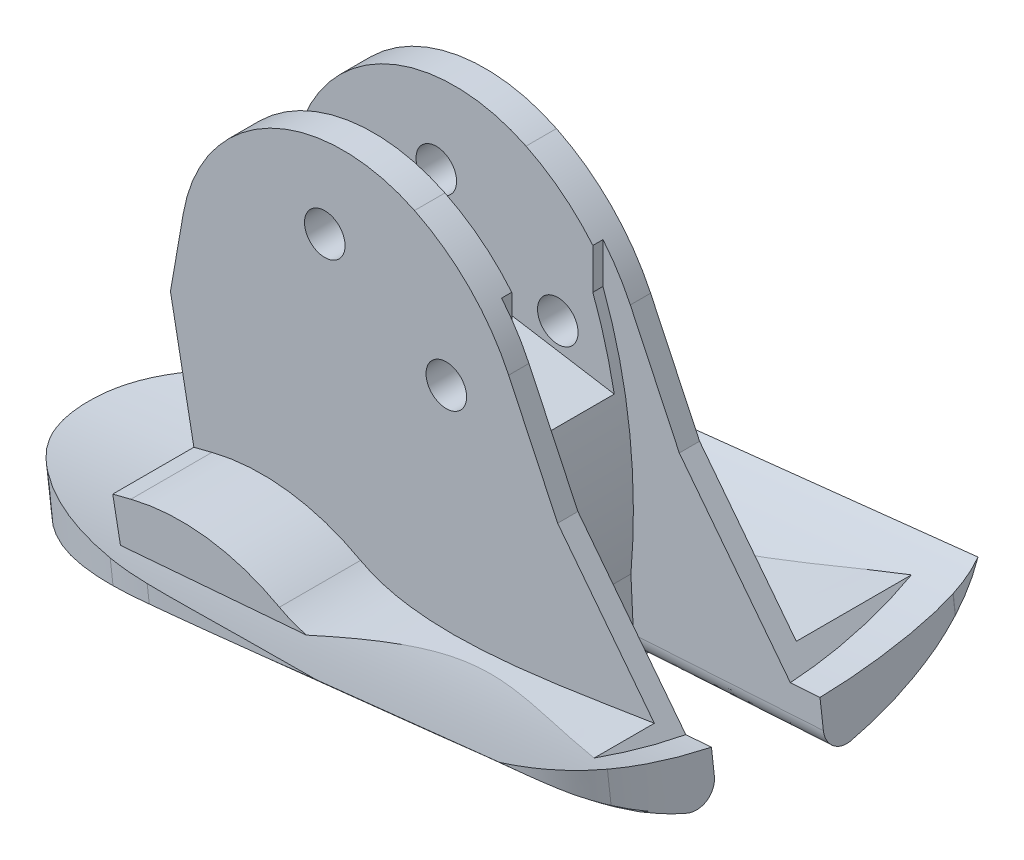
from build123d import *

# Parameters (mm, degrees)
SKETCH10_R                = 1
BOSS_EXTRUDE5_DEPTH       = 7.5
CUT_EXTRUDE1_DEPTH        = 4
FILLET1_R                 = 10
CUT_EXTRUDE6_START        = -11
CUT_EXTRUDE6_DEPTH        = 10
CUT_EXTRUDE7_DEPTH        = 2
BOSS_EXTRUDE11_DEPTH      = 9
CUT_EXTRUDE9_DEPTH        = 9
FILLET2_R                 = 8
FILLET3_R                 = 10
BOSS_EXTRUDE15_DEPTH      = 2
BOSS_EXTRUDE16_DEPTH      = 50
BOSS_EXTRUDE16_DEPTH_BACK = 10
CUT_EXTRUDE10_DEPTH       = 72
CUT_EXTRUDE10_DEPTH_BACK  = 30
SKETCH35_R                = 55.402587586
CUT_EXTRUDE11_DEPTH       = 35
CUT_EXTRUDE11_DEPTH_BACK  = 10
CUT_EXTRUDE13_DEPTH       = 2.5
FILLET4_R                 = 1
CUT_EXTRUDE14_DEPTH       = 10
CUT_EXTRUDE14_DEPTH_BACK  = 10


with BuildPart() as part:
    # Sketch10 → Boss-Extrude5 (new, symmetric)
    with BuildSketch(Plane.XY):
        Polygon((24.800982713, 46.206909386), (29.373769335, 36.52146178), (36.993816658, 26.682834617), (12.788755024, 23.658848526), (10.279677841, 36.875809012), (12.321789019, 48.656944563), align=None)
        with Locations((17.890076876, 43.12952492)):
            Circle(SKETCH10_R, mode=Mode.SUBTRACT)
        with Locations((23.882298789, 39.668364252)):
            Circle(SKETCH10_R, mode=Mode.SUBTRACT)
    extrude(amount=BOSS_EXTRUDE5_DEPTH, both=True)

    # Sketch11 → Cut-Extrude1 (cut)
    with BuildSketch(Plane.XY.offset(7.5)):
        with BuildLine():
            Line((17.825431655, 32.423947427), (9.123881611, 30.207909529))
            Line((9.123881611, 30.207909529), (6.594316119, 53.15991455))
            Line((6.594316119, 53.15991455), (34.693470887, 60.271659822))
            Line((34.693470887, 60.271659822), (37.752907488, 30.846026516))
            add(Edge.make_bspline(
                [(37.752907488, 30.846026516), (30.679137573, 30.15507536), (19.269012528, 26.734198276), (17.825431655, 32.423947427)],
                knots=[0, 0, 0, 0, 1, 1, 1, 1], degree=3))
        make_face()
    extrude(amount=-CUT_EXTRUDE1_DEPTH, mode=Mode.SUBTRACT)

    # Fillet1
    fillet1_edges = [part.edges().sort_by_distance(p)[0] for p in [
        (24.800982713, 46.206909386, -2),
    ]]
    fillet(fillet1_edges, radius=FILLET1_R)

    # Sketch11<2> → Cut-Extrude6 (cut)
    with BuildSketch(Plane.XY.offset(7.5).offset(CUT_EXTRUDE6_START)):
        with BuildLine():
            Line((17.825431655, 32.423947427), (9.123881611, 30.207909529))
            Line((9.123881611, 30.207909529), (6.594316119, 53.15991455))
            Line((6.594316119, 53.15991455), (34.693470887, 60.271659822))
            Line((34.693470887, 60.271659822), (37.752907488, 30.846026516))
            add(Edge.make_bspline(
                [(37.752907488, 30.846026516), (30.679137573, 30.15507536), (19.269012528, 26.734198276), (17.825431655, 32.423947427)],
                knots=[0, 0, 0, 0, 1, 1, 1, 1], degree=3))
        make_face()
    extrude(amount=-CUT_EXTRUDE6_DEPTH, mode=Mode.SUBTRACT)

    # Sketch16 → Cut-Extrude7 (cut, symmetric)
    with BuildSketch(Plane.XY):
        Polygon((10.074284509, 54.36084815), (34.418624568, 54.36084815), (34.418624568, 36.664364271), (10.074284509, 40.645108775), align=None)
    extrude(amount=CUT_EXTRUDE7_DEPTH, both=True, mode=Mode.SUBTRACT)

    # Sketch26 → Boss-Extrude11 (add)
    with BuildSketch(Plane(origin=(36.040611594, 27.913565719, 0), x_dir=(0, 0, -1), z_dir=(0.7906052239960584, 0.6123262037428601, 0))):
        Polygon((3.5, 10.887729805), (-3.5, 10.887729805), (-3.5, 3.097750314), (-7.5, 3.097750314), (-7.5, -1.556694877), (7.5, -1.556694877), (7.5, 3.097750314), (3.5, 3.097750314), align=None)
    extrude(amount=BOSS_EXTRUDE11_DEPTH)

    # Sketch32 → Cut-Extrude9 (cut)
    with BuildSketch(Plane(origin=(43.156058609, 33.424501552, 0), x_dir=(0, 0, -1), z_dir=(0.7906052239960583, 0.6123262037428603, 0))):
        Polygon((3.5, 10.887729805), (-3.5, 10.887729805), (-3.5, 3.097750314), (-7.5, 3.097750314), (-7.5, -1.556694877), (7.5, -1.556694877), (7.5, 3.097750314), (3.5, 3.097750314), align=None)
    extrude(amount=-CUT_EXTRUDE9_DEPTH, mode=Mode.SUBTRACT)

    # Fillet2
    fillet2_edges = [part.edges().sort_by_distance(p)[0] for p in [
        (12.321789019, 48.656944563, 2.75),
        (12.321789019, 48.656944563, -2.75),
    ]]
    fillet(fillet2_edges, radius=FILLET2_R)

    # Fillet3
    fillet3_edges = [part.edges().sort_by_distance(p)[0] for p in [
        (17.825431655, 32.423947427, 5.5),
        (17.825431655, 32.423947427, -5.5),
    ]]
    fillet(fillet3_edges, radius=FILLET3_R)

    # Sketch33 → Boss-Extrude15 (add)
    with BuildSketch(Plane(origin=(0, 0, -7.5), x_dir=(-1, 0, 0), z_dir=(0, 0, -1))):
        with BuildLine():
            Line((-12.788755024, 23.658848526), (-11.433819556, 30.796185182))
            Line((-11.433819556, 30.796185182), (-12.326379112, 31.023494775))
            ThreePointArc((-12.326379112, 31.023494775), (-16.080268918, 31.249787506), (-19.652288318, 30.073533078))
            add(Edge.make_bspline(
                [(-19.652288318, 30.073533078), (-22.736081617, 28.359604072), (-28.881324174, 29.544383842), (-34.143777904, 30.362663299)],
                knots=[0.191604014, 0.191604014, 0.191604014, 0.191604014, 0.842502128, 0.842502128, 0.842502128, 0.842502128], degree=3))
            Line((-34.143777904, 30.362663299), (-36.993816658, 26.682834617))
            Line((-36.993816658, 26.682834617), (-12.788755024, 23.658848526))
        make_face()
    extrude(amount=BOSS_EXTRUDE15_DEPTH)

    # Sketch34 → Boss-Extrude16 (add, two sides: drawn at the far end of the back side and taken through both)
    with BuildSketch(Plane(origin=(36.597192761, 26.906452385, -1.160255626), x_dir=(0.04321821705497575, 0.003059083284290857, 0.9990609729761487), z_dir=(-0.9965676258845166, -0.07053931359849483, 0.0433263462104898)).offset(-BOSS_EXTRUDE16_DEPTH_BACK)):
        with BuildLine():
            add(Edge.make_bspline(
                [(10.962786318, 4.622239084), (3.477027295, -2.408718941), (-3.521324785, -0.251063561), (-6.924030749, 1.436687227), (-9.80602641, 4.145717831)],
                knots=[0, 0, 0, 0, 0, 1, 1, 1, 1, 1], degree=4))
            add(Edge.make_bspline(
                [(10.962786318, 4.622239084), (5.102895066, 2.718145103), (1.095664304, 2.097978438), (-5.296822865, 2.527324591), (-9.80602641, 4.145717831)],
                knots=[0, 0, 0, 0, 0, 1, 1, 1, 1, 1], degree=4))
        make_face()
    extrude(amount=BOSS_EXTRUDE16_DEPTH + BOSS_EXTRUDE16_DEPTH_BACK)

    # Sketch35 → Cut-Extrude10 (cut, two sides: drawn at the far end of the back side and taken through both)
    with BuildSketch(Plane(origin=(-2.713783032, 21.72208587, 0), x_dir=(0.9922861825342592, 0.12396826993867012, 0), z_dir=(0.12396826993867012, -0.9922861825342592, 0)).offset(-CUT_EXTRUDE10_DEPTH_BACK)):
        with Locations((27.392722065, -0.627909345)):
            Circle(SKETCH35_R)
        with BuildLine():
            Line((39.612352512, -9.273588573), (39.614007802, -9.258869605))
            add(Edge.make_bspline(
                [(39.614007802, -9.258869605), (39.678830946, -8.678837107), (39.70351823, -8.072212932), (39.729849907, -6.806621918), (39.731133165, -6.143176432), (39.72807294, -4.796526143), (39.722243082, -4.110775413), (39.707188448, -3.063444166), (39.70097799, -2.711206892), (39.68347428, -2.000348716), (39.671823767, -1.640404861), (39.624420663, -0.569092492), (39.578570516, 0.138484587), (39.466763781, 1.541625381), (39.400759424, 2.238979443), (39.243197791, 3.613640689), (39.153160573, 4.278350971), (38.929984455, 5.562418423), (38.797859709, 6.181847542), (38.615779874, 6.77517355)],
                knots=[0, 0, 0, 0, 0.125, 0.125, 0.25, 0.25, 0.375, 0.375, 0.4375, 0.4375, 0.5, 0.5, 0.625, 0.625, 0.75, 0.75, 0.875, 0.875, 1, 1, 1, 1], degree=3))
            add(Edge.make_bspline(
                [(38.615779874, 6.77517355), (38.487920813, 7.191815545), (38.333560113, 7.586691965), (37.958116521, 8.333189293), (37.742711303, 8.689343865), (37.348477305, 9.165011041), (37.204538088, 9.314261632), (36.892817511, 9.596204225), (36.724465126, 9.729564062), (36.358337391, 9.974042405), (36.163506297, 10.082653847), (35.744263752, 10.269001922), (35.516776676, 10.347060586), (35.046252401, 10.469389366), (34.804345648, 10.514410719), (34.310984083, 10.581957019), (34.058566841, 10.604456086), (33.30742604, 10.647747866), (32.808915952, 10.64625525), (31.813939695, 10.615189938), (31.31752463, 10.584883628), (30.325753881, 10.508681123), (29.830412067, 10.462595811), (29.335320346, 10.41230934)],
                knots=[0, 0, 0, 0, 0.125, 0.125, 0.25, 0.25, 0.3125, 0.3125, 0.375, 0.375, 0.4375, 0.4375, 0.5, 0.5, 0.5625, 0.5625, 0.625, 0.625, 0.75, 0.75, 0.875, 0.875, 1, 1, 1, 1], degree=3))
            add(Edge.make_bspline(
                [(29.335320346, 10.41230934), (28.420686227, 10.319409945), (27.508389025, 10.213312798), (25.682320102, 10.002702576), (24.768587706, 9.89776067), (22.938362135, 9.69895626), (22.021810483, 9.605894719), (20.646978682, 9.463874306), (20.188746807, 9.415803906), (19.273568304, 9.311327474), (18.816693548, 9.25505134), (18.361962746, 9.187148629)],
                knots=[0, 0, 0, 0, 0.25, 0.25, 0.5, 0.5, 0.75, 0.75, 0.875, 0.875, 1, 1, 1, 1], degree=3))
            add(Edge.make_bspline(
                [(18.361962746, 9.187148629), (17.956199827, 9.126558051), (17.55346239, 9.056587652), (16.759171766, 8.881516247), (16.368089203, 8.774935449), (15.981024819, 8.65459847)],
                knots=[0, 0, 0, 0, 0.5, 0.5, 1, 1, 1, 1], degree=3))
            add(Edge.make_bspline(
                [(15.981024819, 8.65459847), (15.290402348, 8.43988633), (14.615504895, 8.188315656), (13.292937001, 7.628145556), (12.64504143, 7.315324561), (11.386117969, 6.626616127), (10.773630282, 6.248191555), (9.889978023, 5.627415008), (9.601636398, 5.411867492), (9.039664085, 4.960251351), (8.765702036, 4.724581942), (8.503254923, 4.473381337)],
                knots=[0, 0, 0, 0, 0.25, 0.25, 0.5, 0.5, 0.75, 0.75, 0.875, 0.875, 1, 1, 1, 1], degree=3))
            add(Edge.make_bspline(
                [(8.503254923, 4.473381337), (8.217366265, 4.199743714), (7.949758166, 3.911635473), (7.473919955, 3.289205771), (7.265335012, 2.955137609), (7.094666539, 2.591128146)],
                knots=[0, 0, 0, 0, 0.5, 0.5, 1, 1, 1, 1], degree=3))
            add(Edge.make_bspline(
                [(7.094666539, 2.591128146), (6.960583341, 2.305149418), (6.853233951, 2.007539952), (6.697211007, 1.402457797), (6.64717371, 1.093308783), (6.604945996, 0.461257959), (6.613959482, 0.144805472), (6.691974824, -0.474257497), (6.761652403, -0.779078241), (6.867186396, -1.078514879)],
                knots=[0, 0, 0, 0, 0.25, 0.25, 0.5, 0.5, 0.75, 0.75, 1, 1, 1, 1], degree=3))
            add(Edge.make_bspline(
                [(6.867186396, -1.078514879), (6.933493626, -1.266651548), (7.01345076, -1.45015825), (7.194634668, -1.800930835), (7.295732392, -1.968596045), (7.625324321, -2.452356741), (7.879822883, -2.749451198), (8.153607635, -3.03224787)],
                knots=[0, 0, 0, 0, 0.25, 0.25, 0.5, 0.5, 1, 1, 1, 1], degree=3))
            add(Edge.make_bspline(
                [(8.153607635, -3.03224787), (8.404302614, -3.291194744), (8.667243367, -3.534314337), (9.206562411, -4.002452402), (9.483315343, -4.227023415), (10.329574137, -4.879019484), (10.915949297, -5.285664484), (12.117322846, -6.049861689), (12.730934725, -6.408159085), (13.978582566, -7.087726179), (14.611573332, -7.409145334), (15.252755396, -7.713303907)],
                knots=[0, 0, 0, 0, 0.125, 0.125, 0.25, 0.25, 0.5, 0.5, 0.75, 0.75, 1, 1, 1, 1], degree=3))
            add(Edge.make_bspline(
                [(15.252755396, -7.713303907), (15.86877354, -8.005525431), (16.492212255, -8.278590671), (17.771769247, -8.756513617), (18.425851357, -8.965515171), (19.087300383, -9.15912614)],
                knots=[0, 0, 0, 0, 0.5, 0.5, 1, 1, 1, 1], degree=3))
            add(Edge.make_bspline(
                [(19.087300383, -9.15912614), (20.058137345, -9.443297222), (21.039859229, -9.695391439), (22.999868491, -10.201988455), (23.979488745, -10.452823481), (24.956502389, -10.705877336)],
                knots=[0, 0, 0, 0, 0.5, 0.5, 1, 1, 1, 1], degree=3))
            add(Edge.make_bspline(
                [(24.956502389, -10.705877336), (25.521222033, -10.852143956), (26.085137459, -10.998809958), (27.212752038, -11.289646307), (27.776310477, -11.434097641), (28.342251215, -11.571931792)],
                knots=[0, 0, 0, 0, 0.5, 0.5, 1, 1, 1, 1], degree=3))
            add(Edge.make_bspline(
                [(28.342251215, -11.571931792), (29.351914607, -11.817834034), (30.370480744, -12.040953623), (32.441968076, -12.372764474), (33.491309427, -12.481919508), (34.541668096, -12.564489847)],
                knots=[0, 0, 0, 0, 0.5, 0.5, 1, 1, 1, 1], degree=3))
            add(Edge.make_bspline(
                [(34.541668096, -12.564489847), (34.827957124, -12.586995476), (35.114243751, -12.607613895), (35.686800238, -12.641216663), (35.973070266, -12.654439328), (36.545572859, -12.664271489), (36.831466903, -12.661664717), (37.249817974, -12.624365087), (37.388988008, -12.605761099), (37.653254672, -12.54985343), (37.778152113, -12.512470828), (37.894664133, -12.463755626)],
                knots=[0, 0, 0, 0, 0.25, 0.25, 0.5, 0.5, 0.75, 0.75, 0.875, 0.875, 1, 1, 1, 1], degree=3))
            add(Edge.make_bspline(
                [(37.894664133, -12.463755626), (37.976109988, -12.429702048), (38.051946409, -12.39100221), (38.123616577, -12.348656129)],
                knots=[0, 0, 0, 0, 1, 1, 1, 1], degree=3))
            add(Edge.make_bspline(
                [(38.123616577, -12.348656129), (38.262401642, -12.266655434), (38.383818423, -12.172079191), (38.600694294, -11.968787379), (38.695730198, -11.860444538), (38.953701251, -11.519211595), (39.090701699, -11.268081663), (39.311292558, -10.740757161), (39.396324815, -10.464469902), (39.498585094, -10.032138729), (39.525513364, -9.88445278), (39.573735272, -9.583427039), (39.594649145, -9.430016289), (39.612352512, -9.273588573)],
                knots=[0, 0, 0, 0, 0.125, 0.125, 0.25, 0.25, 0.5, 0.5, 0.75, 0.75, 0.875, 0.875, 1, 1, 1, 1], degree=3))
        make_face(mode=Mode.SUBTRACT)
    extrude(amount=CUT_EXTRUDE10_DEPTH + CUT_EXTRUDE10_DEPTH_BACK, mode=Mode.SUBTRACT)

    # Sketch36 → Cut-Extrude11 (cut, two sides: drawn at the far end of the back side and taken through both)
    with BuildSketch(Plane(origin=(36.597192761, 26.906452385, -1.160255626), x_dir=(0.04321821705497575, 0.003059083284290857, 0.9990609729761487), z_dir=(-0.9965676258845166, -0.07053931359849483, 0.0433263462104898)).offset(-CUT_EXTRUDE11_DEPTH_BACK)):
        with BuildLine():
            Line((-11.629437705, 6.127401317), (-10.836764357, -5.045897527))
            Line((-10.836764357, -5.045897527), (4.676891988, -6.772500476))
            Line((4.676891988, -6.772500476), (13.026434605, -2.468878201))
            Line((13.026434605, -2.468878201), (11.841552256, 5.534498248))
            add(Edge.make_bspline(
                [(-11.629437705, 6.127401317), (-6.430667289, -1.000085375), (3.087976812, -1.746160943), (7.225611875, 0.894114509), (11.841552256, 5.534498248)],
                knots=[0, 0, 0, 0, 0, 1, 1, 1, 1, 1], degree=4))
        make_face()
    extrude(amount=CUT_EXTRUDE11_DEPTH + CUT_EXTRUDE11_DEPTH_BACK, mode=Mode.SUBTRACT)

    # Sketch38 → Cut-Extrude13 (cut, symmetric)
    with BuildSketch(Plane.XY):
        with BuildLine():
            Line((25.610790382, 47.784392592), (25.610790382, 41.753407195))
            add(Edge.make_bspline(
                [(25.610790382, 41.753407195), (27.534154842, 36.606564082), (26.987597253, 30.159272712)],
                knots=[0, 0, 0, 1, 1, 1], degree=2))
            Line((26.987597253, 30.159272712), (27.418107076, 21.424973651))
            Line((27.418107076, 21.424973651), (39.921059833, 21.424973651))
            Line((39.921059833, 21.424973651), (37.073040227, 47.784392592))
            Line((37.073040227, 47.784392592), (25.610790382, 47.784392592))
        make_face()
    extrude(amount=CUT_EXTRUDE13_DEPTH, both=True, mode=Mode.SUBTRACT)

    # Fillet4
    fillet4_edges = [part.edges().sort_by_distance(p)[0] for p in [
        (31.717406541, 26.901141956, 2.5),
        (31.850594129, 26.733162449, -2.5),
    ]]
    fillet(fillet4_edges, radius=FILLET4_R)

    # Sketch39 → Cut-Extrude14 (cut, two sides: drawn at the far end of the back side and taken through both)
    with BuildSketch(Plane(origin=(18.782584697, 29.777684444, 0), x_dir=(0.8458013271961672, -0.5334979989776929, 0), z_dir=(0.5334979989776929, 0.8458013271961672, 0)).offset(-CUT_EXTRUDE14_DEPTH_BACK)):
        with BuildLine():
            Line((-3.463312939, 6.5), (1.536687061, 6.5))
            ThreePointArc((1.536687061, 6.5), (3.036687061, 5), (1.536687061, 3.5))
            Line((1.536687061, 3.5), (-3.463312939, 3.5))
            ThreePointArc((-3.463312939, 3.5), (-4.963312939, 5), (-3.463312939, 6.5))
        make_face()
    extrude(amount=CUT_EXTRUDE14_DEPTH + CUT_EXTRUDE14_DEPTH_BACK, mode=Mode.SUBTRACT)


solid = part.part
